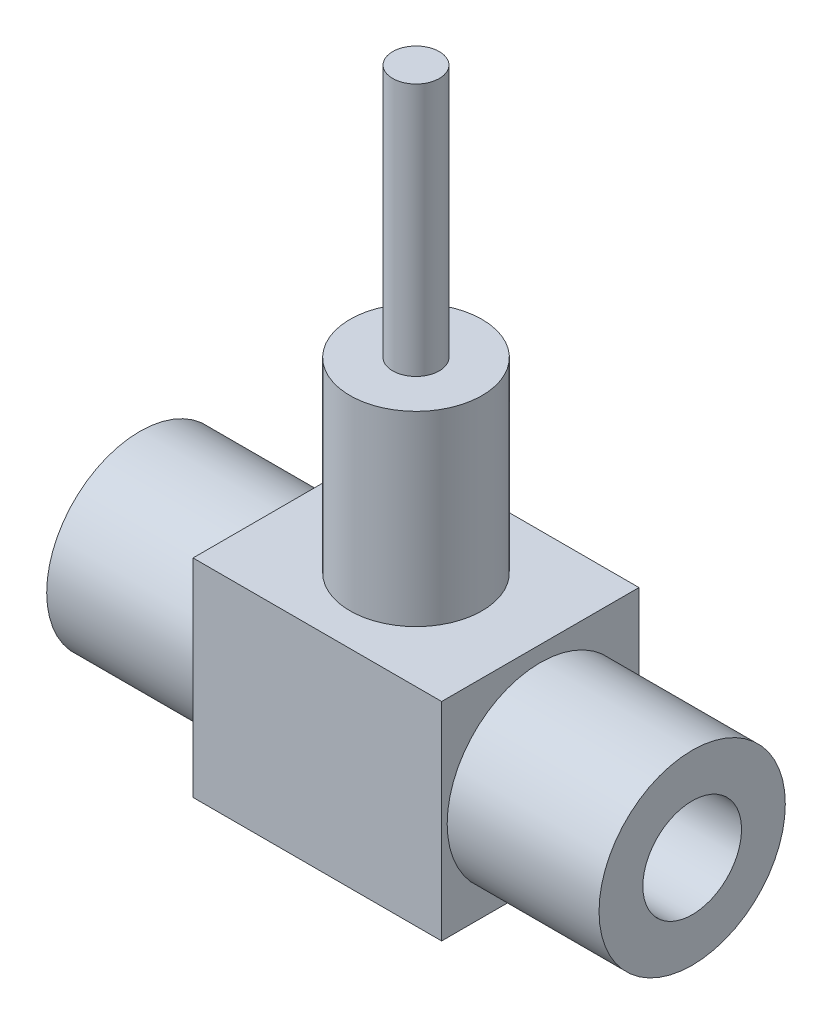
from build123d import *

# Parameters (mm, degrees)
BODY_SKETCH_W                   = 32
BODY_SKETCH_H                   = 26.7
BODY_DEPTH                      = 12.7
NUT_X_SKETCH_W                  = 19.55
NUT_X_SKETCH_H                  = 11.988
NUT_X_SKETCH_2_W                = 19.55
NUT_X_SKETCH_2_H                = 11.988
SOCKET_X_SKETCH_W               = 23.9
SOCKET_X_SKETCH_H               = 6.35
SOCKET_X_SKETCH_2_W             = 23.9
SOCKET_X_SKETCH_2_H             = 6.35
TORCH_NITROUS_PORT_SKETCH_R     = 3.5
TORCH_NITROUS_PORT_DEPTH        = 8.6
TORCH_NITROUS_DRILLING_SKETCH_R = 1
TORCH_NITROUS_DRILLING_DEPTH    = 12.7


with BuildPart() as part:
    # Body Sketch → Body (new, symmetric)
    with BuildSketch(Plane.XY):
        with Locations((0, 0.65)):
            Rectangle(BODY_SKETCH_W, BODY_SKETCH_H)
    extrude(amount=BODY_DEPTH, both=True)

    # Nut _X Sketch → Nut _X (revolve)
    with BuildSketch(Plane.XY):
        with Locations((25.775, 5.994)):
            Rectangle(NUT_X_SKETCH_W, NUT_X_SKETCH_H)
    revolve(axis=Axis((-1000, 0, 0), (1, 0, 0)))

    # Nut -X Sketch 2 → Nut -X 2 (revolve)
    with BuildSketch(Plane.XY):
        with Locations((-25.775, 5.994)):
            Rectangle(NUT_X_SKETCH_2_W, NUT_X_SKETCH_2_H)
    revolve(axis=Axis((-1000, 0, 0), (1, 0, 0)))

    # Socket _X Sketch → Socket _X (revolve, cut)
    with BuildSketch(Plane.XY):
        with Locations((24.6, 3.175)):
            Rectangle(SOCKET_X_SKETCH_W, SOCKET_X_SKETCH_H)
    revolve(axis=Axis((-1000, 0, 0), (1, 0, 0)), mode=Mode.SUBTRACT)

    # Socket -X Sketch 2 → Socket -X 2 (revolve, cut)
    with BuildSketch(Plane.XY):
        with Locations((-24.6, 3.175)):
            Rectangle(SOCKET_X_SKETCH_2_W, SOCKET_X_SKETCH_2_H)
    revolve(axis=Axis((-1000, 0, 0), (1, 0, 0)), mode=Mode.SUBTRACT)

    # Stem Sketch → Stem (revolve)
    with BuildSketch(Plane.XY):
        Polygon((0, 14), (8.5, 14), (8.5, 38), (3, 38), (3, 70.6), (0, 70.6), align=None)
    revolve(axis=Axis((0, -500, 0), (0, 1, 0)))

    # Torch Nitrous Port Sketch → Torch Nitrous Port (cut)
    with BuildSketch(Plane.XY.offset(-12.7)):
        with Locations((-8, 0)):
            Circle(TORCH_NITROUS_PORT_SKETCH_R)
    extrude(amount=TORCH_NITROUS_PORT_DEPTH, mode=Mode.SUBTRACT)

    # Torch Nitrous Drilling Sketch → Torch Nitrous Drilling (cut)
    with BuildSketch(Plane.XY.offset(-12.7)):
        with Locations((-8, 0)):
            Circle(TORCH_NITROUS_DRILLING_SKETCH_R)
    extrude(amount=TORCH_NITROUS_DRILLING_DEPTH, mode=Mode.SUBTRACT)


solid = part.part
